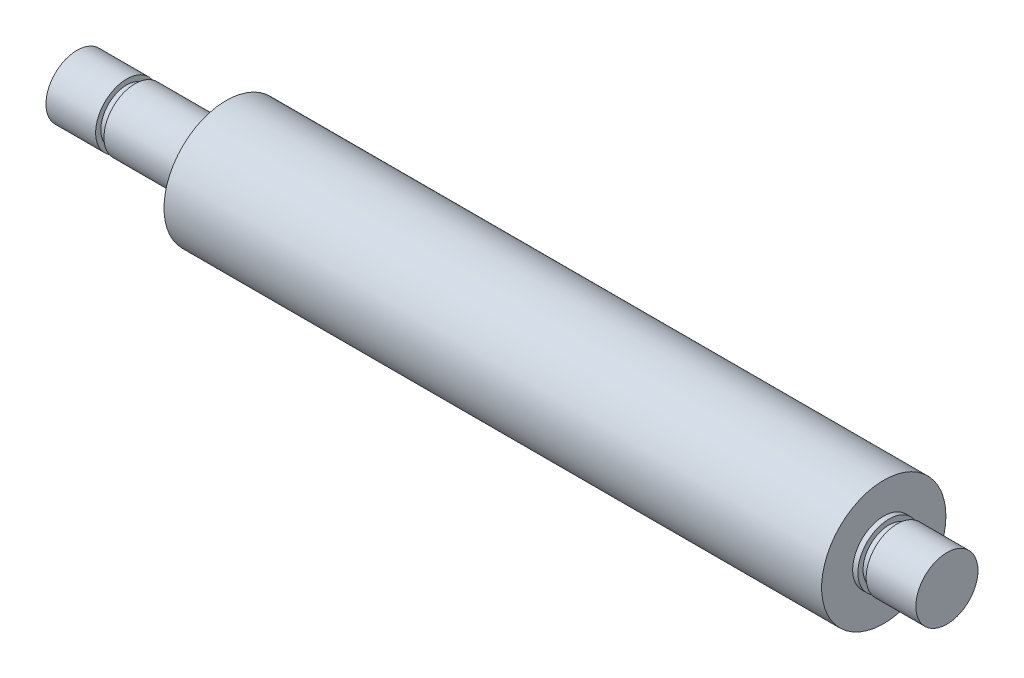
from build123d import *


with BuildPart() as part:
    # Sketch1 → Revolve1 (revolve)
    with BuildSketch(Plane.XY, mode=Mode.PRIVATE) as revolve1_sk:
        Polygon((-42, 3), (-42, 0), (42, 0), (42, 3), (37.2, 3), (37.2, 2.5), (36.4, 2.5), (36.4, 3), (35.9, 3), (35.9, 6), (-27.6, 6), (-27.6, 3), (-36.4, 3), (-36.4, 2.5), (-37.2, 2.5), (-37.2, 3), align=None)
    revolve(revolve1_sk.sketch.rotate(Axis((-42, 0, 0), (1, 0, 0)), 270), axis=Axis((-42, 0, 0), (1, 0, 0)))


solid = part.part
